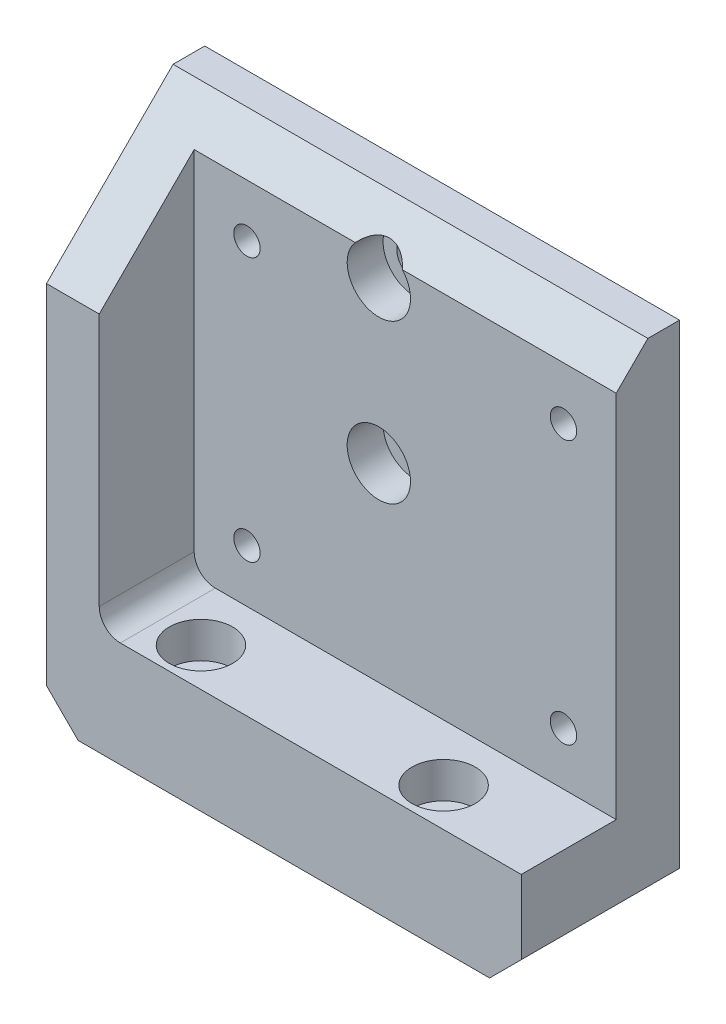
from build123d import *

# Parameters (mm, degrees)
SKETCH1_W                                            = 45
SKETCH1_H                                            = 48
BOSS_EXTRUDE1_DEPTH                                  = 6
SKETCH2_W                                            = 45
SKETCH2_H                                            = 15
BOSS_EXTRUDE2_DEPTH                                  = 10
CBORE_FOR_M3_HEXAGON_SOCKET_HEAD_CAP_SCR_D           = 3.4
CBORE_FOR_M3_HEXAGON_SOCKET_HEAD_CAP_SCR_DEPTH       = 15
CBORE_FOR_M3_HEXAGON_SOCKET_HEAD_CAP_SCR_CBORE_D     = 6
CBORE_FOR_M3_HEXAGON_SOCKET_HEAD_CAP_SCR_CBORE_DEPTH = 3.4
CBORE_FOR_M3_HEXAGON_SOCKET_HEAD_CAP_SCR_TIP         = 1.021463052
SKETCH6_W                                            = 5
SKETCH6_H                                            = 38
BOSS_EXTRUDE3_DEPTH                                  = 9
FILLET1_R                                            = 2
CBORE_FOR_M3_HEXAGON_SOCKET_HEAD_CAP_2_D             = 3.4
CBORE_FOR_M3_HEXAGON_SOCKET_HEAD_CAP_2_CBORE_D       = 6
CBORE_FOR_M3_HEXAGON_SOCKET_HEAD_CAP_2_CBORE_DEPTH   = 3.4
CHAMFER3_SIZE                                        = 3
CUT_EXTRUDE1_DEPTH                                   = 54.16013544
CUT_EXTRUDE1_DEPTH_BACK                              = 54.16013544
M3_TAPPED_HOLE1_D                                    = 2.5
M3_TAPPED_HOLE1_DEPTH                                = 4
M3_TAPPED_HOLE1_TIP                                  = 0.751075774


with BuildPart() as part:
    # Sketch1 → Boss-Extrude1 (new body)
    with BuildSketch(Plane.XY):
        Rectangle(SKETCH1_W, SKETCH1_H)
    extrude(amount=BOSS_EXTRUDE1_DEPTH)

    # Sketch2 → Boss-Extrude2 (add)
    with BuildSketch(Plane.XZ.offset(24)):
        with Locations((0, 7.5)):
            Rectangle(SKETCH2_W, SKETCH2_H)
    extrude(amount=-BOSS_EXTRUDE2_DEPTH)

    # CBORE for M3 Hexagon socket head cap scr
    with Locations(Plane(origin=(0, -14, 0), x_dir=(1, 0, 0), z_dir=(0, 1, 0))):
        with Locations((-11.5, -11.36), (11.5, -11.36)):
            CounterBoreHole(CBORE_FOR_M3_HEXAGON_SOCKET_HEAD_CAP_SCR_D / 2, CBORE_FOR_M3_HEXAGON_SOCKET_HEAD_CAP_SCR_CBORE_D / 2, CBORE_FOR_M3_HEXAGON_SOCKET_HEAD_CAP_SCR_CBORE_DEPTH, depth=CBORE_FOR_M3_HEXAGON_SOCKET_HEAD_CAP_SCR_DEPTH)
            with Locations((0, 0, -(CBORE_FOR_M3_HEXAGON_SOCKET_HEAD_CAP_SCR_DEPTH + CBORE_FOR_M3_HEXAGON_SOCKET_HEAD_CAP_SCR_TIP / 2))):  # 118° drill point
                Cone(0, CBORE_FOR_M3_HEXAGON_SOCKET_HEAD_CAP_SCR_D / 2, CBORE_FOR_M3_HEXAGON_SOCKET_HEAD_CAP_SCR_TIP, mode=Mode.SUBTRACT)

    # Sketch6 → Boss-Extrude3 (add)
    with BuildSketch(Plane.XY.offset(6)):
        with Locations((-20, 5)):
            Rectangle(SKETCH6_W, SKETCH6_H)
    extrude(amount=BOSS_EXTRUDE3_DEPTH)

    # Fillet1
    fillet1_edges = [part.edges().sort_by_distance(p)[0] for p in [
        (-17.5, -14, 10.5),
    ]]
    fillet(fillet1_edges, radius=FILLET1_R)

    # CBORE for M3 Hexagon socket head cap 2 (through all)
    with Locations(Plane.XY.offset(6)):
        with Locations((0, 19), (0, 4)):
            CounterBoreHole(CBORE_FOR_M3_HEXAGON_SOCKET_HEAD_CAP_2_D / 2, CBORE_FOR_M3_HEXAGON_SOCKET_HEAD_CAP_2_CBORE_D / 2, CBORE_FOR_M3_HEXAGON_SOCKET_HEAD_CAP_2_CBORE_DEPTH)

    # Chamfer3
    chamfer3_edges = [part.edges().sort_by_distance(p)[0] for p in [
        (22.5, -24, 7.5),
        (-22.5, -24, 7.5),
    ]]
    chamfer(chamfer3_edges, length=CHAMFER3_SIZE)

    # Sketch9 → Cut-Extrude1 (cut, two sides: drawn at the far end of the back side and taken through both)
    with BuildSketch(Plane(origin=(22.5, 0, 0), x_dir=(0, 0, -1), z_dir=(1, 0, 0)).offset(-CUT_EXTRUDE1_DEPTH_BACK)):
        Polygon((74.04249055, 101.04249055), (-3, 24), (-15, 12), (-92.04249055, -65.04249055), (-246.12747165, 89.04249055), (-80.04249055, 255.12747165), align=None)
    extrude(amount=CUT_EXTRUDE1_DEPTH + CUT_EXTRUDE1_DEPTH_BACK, mode=Mode.SUBTRACT)

    # M3 Tapped Hole1
    with Locations(Plane.XY.offset(6)):
        with Locations((-12.5, 16), (17.5, 16), (-12.5, -9), (17.5, -9)):
            Hole(M3_TAPPED_HOLE1_D / 2, depth=M3_TAPPED_HOLE1_DEPTH)
            with Locations((0, 0, -(M3_TAPPED_HOLE1_DEPTH + M3_TAPPED_HOLE1_TIP / 2))):  # 118° drill point
                Cone(0, M3_TAPPED_HOLE1_D / 2, M3_TAPPED_HOLE1_TIP, mode=Mode.SUBTRACT)


solid = part.part
